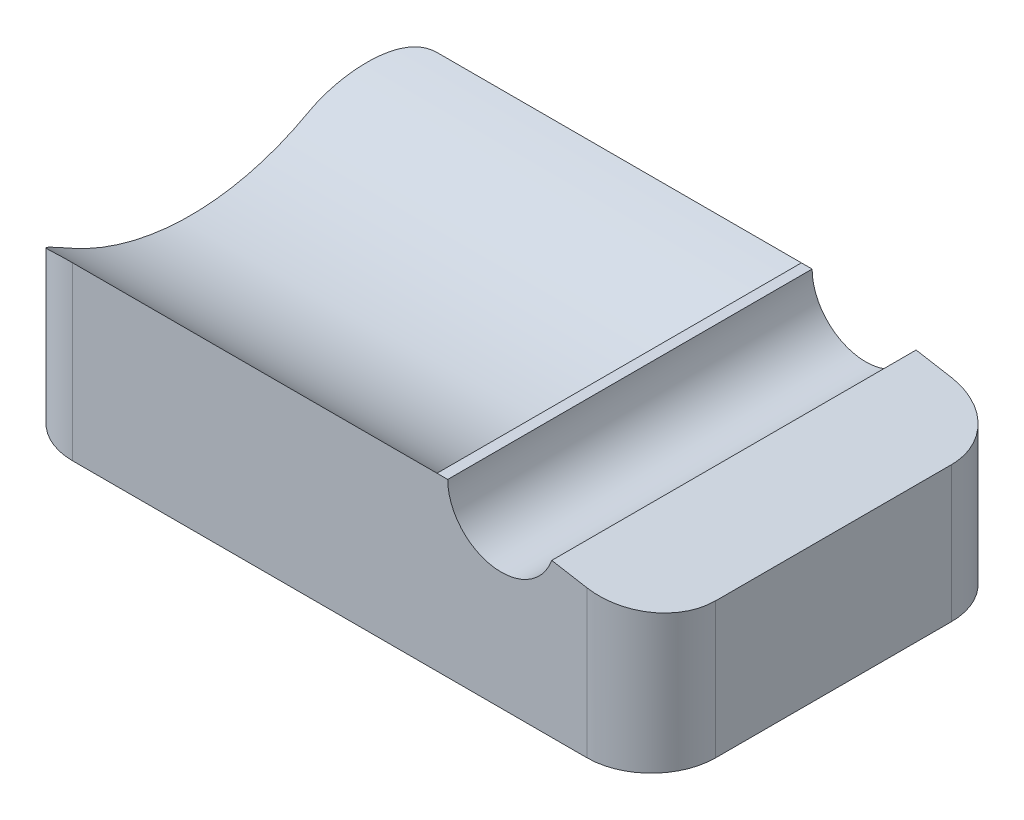
from build123d import *

# Parameters (mm, degrees)
SKETCH1_W           = 60
SKETCH1_H           = 34
BOSS_EXTRUDE1_DEPTH = 16
SKETCH6_R           = 22.671568098
CUT_EXTRUDE4_DEPTH  = 40
SKETCH2_R           = 5
CUT_EXTRUDE1_DEPTH  = 71.795480082
FILLET1_R           = 6
CUT_EXTRUDE3_DEPTH  = 71.795480152
BOSS_EXTRUDE2_DEPTH = 1


with BuildPart() as part:
    # Sketch1 → Boss-Extrude1 (new body)
    with BuildSketch(Plane(origin=(0, 0, 0), x_dir=(1, 0, 0), z_dir=(0, 1, 0))):
        with Locations((30, 17)):
            Rectangle(SKETCH1_W, SKETCH1_H)
    extrude(amount=BOSS_EXTRUDE1_DEPTH)

    # Sketch6 → Cut-Extrude4 (cut)
    with BuildSketch(Plane.ZY):
        with Locations((-17, 31)):
            Circle(SKETCH6_R)
    extrude(amount=-CUT_EXTRUDE4_DEPTH, mode=Mode.SUBTRACT)

    # Sketch2 → Cut-Extrude1 (cut, through all)
    with BuildSketch(Plane.XY):
        with Locations((46, 16)):
            Circle(SKETCH2_R)
    extrude(amount=-CUT_EXTRUDE1_DEPTH, mode=Mode.SUBTRACT)

    # Fillet1
    fillet1_edges = [part.edges().sort_by_distance(p)[0] for p in [
        (0, 8, -34),
        (60, 8, -34),
        (60, 8, 0),
        (0, 8, 0),
    ]]
    fillet(fillet1_edges, radius=FILLET1_R)

    # Sketch5 → Cut-Extrude3 (cut, through all)
    with BuildSketch(Plane.XY):
        Polygon((50.705913613, 14.310509822), (60, 12.692705636), (60, 16), (51, 16), align=None)
    extrude(amount=-CUT_EXTRUDE3_DEPTH, mode=Mode.SUBTRACT)

    # Sketch7 → Boss-Extrude2 (add)
    with BuildSketch(Plane.XZ):
        with BuildLine():
            Line((13, -11), (13, -23))
            Line((13, -23), (12, -23))
            ThreePointArc((12, -23), (8, -17), (12, -11))
            Line((12, -11), (13, -11))
        make_face()
    extrude(amount=BOSS_EXTRUDE2_DEPTH)


solid = part.part
